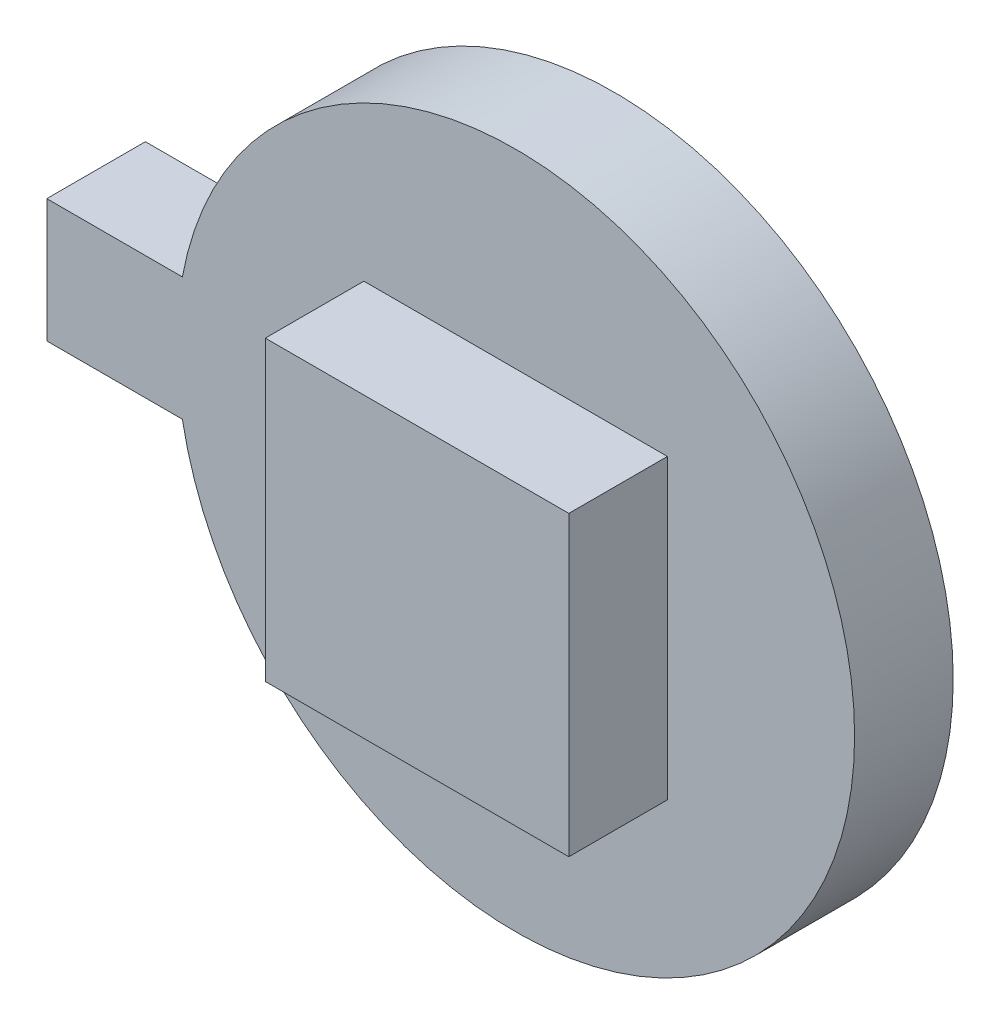
from build123d import *

# Parameters (mm, degrees)
EXTRUDE_1_DEPTH = 1.6
SKETCH_2_W      = 4.925580802
SKETCH_2_H      = 4.825372048
EXTRUDE_2_DEPTH = 1.6


with BuildPart() as part:
    # 草图1 → 凸台-拉伸1 (new body)
    with BuildSketch(Plane.XY):
        with BuildLine():
            Line((-5.408326913, 1), (-7.608326913, 1))
            Line((-7.608326913, 1), (-7.608326913, -1))
            Line((-7.608326913, -1), (-5.408326913, -1))
            ThreePointArc((-5.408326913, -1), (5.5, 0), (-5.408326913, 1))
        make_face()
    extrude(amount=EXTRUDE_1_DEPTH)

    # 草图2 → 凸台-拉伸2 (add)
    with BuildSketch(Plane.XY.offset(1.6)):
        Rectangle(SKETCH_2_W, SKETCH_2_H)
    extrude(amount=EXTRUDE_2_DEPTH)


solid = part.part
